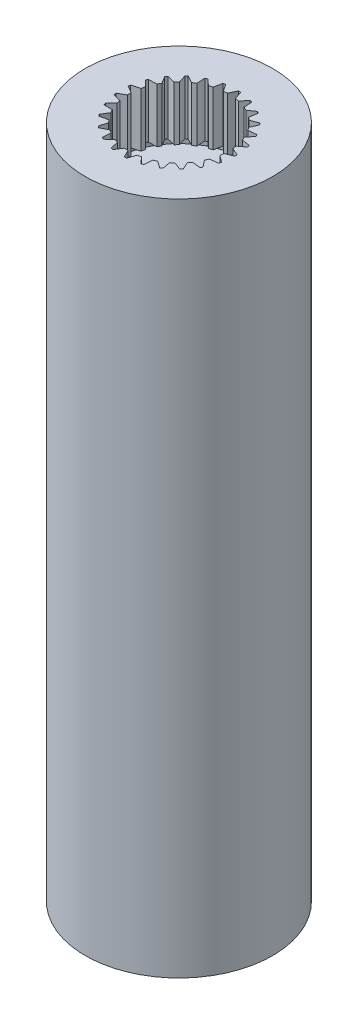
from build123d import *

# Parameters (mm, degrees)
SKETCH1_W          = 5
SKETCH1_H          = 36
SKETCH2_R          = 3.43154
CUT_EXTRUDE1_DEPTH = 0.5
SKETCH3_R          = 3.5
CUT_EXTRUDE2_DEPTH = 31.5
CUT_EXTRUDE3_REACH = 34.284
SKETCH4_R          = 1.5
CUT_EXTRUDE4_REACH = 38.688


with BuildPart() as part:
    # Sketch1 → Revolve1 (revolve)
    with BuildSketch(Plane.XY, mode=Mode.PRIVATE) as revolve1_sk:
        with Locations((2.5, 16.5)):
            Rectangle(SKETCH1_W, SKETCH1_H)
    revolve(revolve1_sk.sketch.rotate(Axis((0, 34.5, 0), (0, -1, 0)), 270), axis=Axis((0, 34.5, 0), (0, -1, 0)))

    # Sketch2 → Cut-Extrude1 (cut)
    with BuildSketch(Plane(origin=(0, 31.6, 0), x_dir=(1, 0, 0), z_dir=(0, 1, 0))):
        with Locations(Location((0, 0, 0), (0, 0, 90))):
            Circle(SKETCH2_R)
    extrude(amount=-CUT_EXTRUDE1_DEPTH, mode=Mode.SUBTRACT)

    # Sketch3 → Cut-Extrude2 (cut)
    with BuildSketch(Plane.XZ.offset(1.5)):
        with Locations(Location((0, 0, 0), (0, 0, 90))):
            Circle(SKETCH3_R)
    extrude(amount=-CUT_EXTRUDE2_DEPTH, mode=Mode.SUBTRACT)

    # Sketch4 → Cut-Extrude3 (cut, up to next)
    with BuildSketch(Plane.XZ.offset(-30), mode=Mode.PRIVATE) as cut_extrude3_sk1:
        with Locations(Location((0, 0, 0), (0, 0, 270))):
            Circle(SKETCH4_R)
    cut_extrude3_tool1 = extrude(cut_extrude3_sk1.sketch, amount=-CUT_EXTRUDE3_REACH, mode=Mode.PRIVATE) & part.part
    add(cut_extrude3_tool1.solids().sort_by_distance((0, 30, 0))[0], mode=Mode.SUBTRACT)

    # Sketch5 → Cut-Extrude4 (cut, up to next)
    with BuildSketch(Plane(origin=(0, 34.5, 0), x_dir=(-1, 0, 0), z_dir=(0, 1, 0)), mode=Mode.PRIVATE) as cut_extrude4_sk1:
        with BuildLine():
            Line((2.430309722, 1.842849602), (1.999275165, 1.739367361))
            ThreePointArc((1.999275165, 1.739367361), (1.931766863, 1.814049831), (1.861470643, 1.886114272))
            Line((1.861470643, 1.886114272), (1.991813569, 2.309800577))
            ThreePointArc((1.991813569, 2.309800577), (1.944143169, 2.35006539), (1.895659013, 2.389346544))
            Line((1.895659013, 2.389346544), (1.503901187, 2.181921452))
            ThreePointArc((1.503901187, 2.181921452), (1.419941007, 2.237469003), (1.333931574, 2.289787448))
            Line((1.333931574, 2.289787448), (1.354813039, 2.732577836))
            ThreePointArc((1.354813039, 2.732577836), (1.298626839, 2.75972251), (1.241897077, 2.785712054))
            Line((1.241897077, 2.785712054), (0.914031566, 2.487377393))
            ThreePointArc((0.914031566, 2.487377393), (0.818895035, 2.520299768), (0.722576679, 2.549584857))
            Line((0.722576679, 2.549584857), (0.632684622, 2.98365718))
            ThreePointArc((0.632684622, 2.98365718), (0.571513009, 2.995976115), (0.51010218, 3.007041032))
            Line((0.51010218, 3.007041032), (0.26672998, 2.636542265))
            ThreePointArc((0.26672998, 2.636542265), (0.166394877, 2.64477083), (0.065819633, 2.649182473))
            Line((0.065819633, 2.649182473), (-0.129197696, 3.047262371))
            ThreePointArc((-0.129197696, 3.047262371), (-0.191511085, 3.043981522), (-0.253744312, 3.039426562))
            Line((-0.253744312, 3.039426562), (-0.397331231, 2.620043491))
            ThreePointArc((-0.397331231, 2.620043491), (-0.496560484, 2.603061214), (-0.595073102, 2.582322211))
            Line((-0.595073102, 2.582322211), (-0.882962048, 2.919396859))
            ThreePointArc((-0.882962048, 2.919396859), (-0.942501833, 2.900722375), (-1.001647117, 2.880833743))
            Line((-1.001647117, 2.880833743), (-1.03642666, 2.438917747))
            ThreePointArc((-1.03642666, 2.438917747), (-1.128315123, 2.397791689), (-1.218575206, 2.353205148))
            Line((-1.218575206, 2.353205148), (-1.581246647, 2.608094906))
            ThreePointArc((-1.581246647, 2.608094906), (-1.634271725, 2.575200173), (-1.686612749, 2.541227545))
            Line((-1.686612749, 2.541227545), (-1.61039959, 2.104545832))
            ThreePointArc((-1.61039959, 2.104545832), (-1.689173573, 2.041860093), (-1.765509747, 1.976227551))
            Line((-1.765509747, 1.976227551), (-2.180175704, 2.132916759))
            ThreePointArc((-2.180175704, 2.132916759), (-2.223354314, 2.087868673), (-2.2656023, 2.041946674))
            Line((-2.2656023, 2.041946674), (-2.083185191, 1.637937563))
            ThreePointArc((-2.083185191, 1.637937563), (-2.143895035, 1.557630919), (-2.201510819, 1.475076308))
            Line((-2.201510819, 1.475076308), (-2.642116303, 1.523719607))
            ThreePointArc((-2.642116303, 1.523719607), (-2.672735374, 1.469348706), (-2.702235725, 1.414362784))
            Line((-2.702235725, 1.414362784), (-2.425076605, 1.068411652))
            ThreePointArc((-2.425076605, 1.068411652), (-2.463907688, 0.975530065), (-2.499182869, 0.881240596))
            Line((-2.499182869, 0.881240596), (-2.938043018, 0.818781548))
            ThreePointArc((-2.938043018, 0.818781548), (-2.954178641, 0.758504156), (-2.969077742, 0.697909279))
            Line((-2.969077742, 0.697909279), (-2.614591538, 0.431753508))
            ThreePointArc((-2.614591538, 0.431753508), (-2.629103958, 0.332133069), (-2.639822068, 0.232033297))
            Line((-2.639822068, 0.232033297), (-3.049361685, 0.062396433))
            ThreePointArc((-3.049361685, 0.062396433), (-3.05, 0), (-3.049361685, -0.062396433))
            Line((-3.049361685, -0.062396433), (-2.639822068, -0.232033297))
            ThreePointArc((-2.639822068, -0.232033297), (-2.629103958, -0.332133069), (-2.614591538, -0.431753508))
            Line((-2.614591538, -0.431753508), (-2.969077742, -0.697909279))
            ThreePointArc((-2.969077742, -0.697909279), (-2.954178641, -0.758504156), (-2.938043018, -0.818781548))
            Line((-2.938043018, -0.818781548), (-2.499182869, -0.881240596))
            ThreePointArc((-2.499182869, -0.881240596), (-2.463907688, -0.975530065), (-2.425076605, -1.068411652))
            Line((-2.425076605, -1.068411652), (-2.702235725, -1.414362784))
            ThreePointArc((-2.702235725, -1.414362784), (-2.672735374, -1.469348706), (-2.642116303, -1.523719607))
            Line((-2.642116303, -1.523719607), (-2.201510819, -1.475076308))
            ThreePointArc((-2.201510819, -1.475076308), (-2.143895035, -1.557630919), (-2.083185191, -1.637937563))
            Line((-2.083185191, -1.637937563), (-2.2656023, -2.041946674))
            ThreePointArc((-2.2656023, -2.041946674), (-2.223354314, -2.087868673), (-2.180175704, -2.132916759))
            Line((-2.180175704, -2.132916759), (-1.765509747, -1.976227551))
            ThreePointArc((-1.765509747, -1.976227551), (-1.689173573, -2.041860093), (-1.61039959, -2.104545832))
            Line((-1.61039959, -2.104545832), (-1.686612749, -2.541227545))
            ThreePointArc((-1.686612749, -2.541227545), (-1.634271725, -2.575200173), (-1.581246647, -2.608094906))
            Line((-1.581246647, -2.608094906), (-1.218575206, -2.353205148))
            ThreePointArc((-1.218575206, -2.353205148), (-1.128315123, -2.397791689), (-1.03642666, -2.438917747))
            Line((-1.03642666, -2.438917747), (-1.001647117, -2.880833743))
            ThreePointArc((-1.001647117, -2.880833743), (-0.942501833, -2.900722375), (-0.882962048, -2.919396859))
            Line((-0.882962048, -2.919396859), (-0.595073102, -2.582322211))
            ThreePointArc((-0.595073102, -2.582322211), (-0.496560484, -2.603061214), (-0.397331231, -2.620043491))
            Line((-0.397331231, -2.620043491), (-0.253744312, -3.039426562))
            ThreePointArc((-0.253744312, -3.039426562), (-0.191511085, -3.043981522), (-0.129197696, -3.047262371))
            Line((-0.129197696, -3.047262371), (0.065819633, -2.649182473))
            ThreePointArc((0.065819633, -2.649182473), (0.166394877, -2.64477083), (0.26672998, -2.636542265))
            Line((0.26672998, -2.636542265), (0.51010218, -3.007041032))
            ThreePointArc((0.51010218, -3.007041032), (0.571513009, -2.995976115), (0.632684622, -2.98365718))
            Line((0.632684622, -2.98365718), (0.722576679, -2.549584857))
            ThreePointArc((0.722576679, -2.549584857), (0.818895035, -2.520299768), (0.914031566, -2.487377393))
            Line((0.914031566, -2.487377393), (1.241897077, -2.785712054))
            ThreePointArc((1.241897077, -2.785712054), (1.298626839, -2.75972251), (1.354813039, -2.732577836))
            Line((1.354813039, -2.732577836), (1.333931574, -2.289787448))
            ThreePointArc((1.333931574, -2.289787448), (1.419941007, -2.237469003), (1.503901187, -2.181921452))
            Line((1.503901187, -2.181921452), (1.895659013, -2.389346544))
            ThreePointArc((1.895659013, -2.389346544), (1.944143169, -2.35006539), (1.991813569, -2.309800577))
            Line((1.991813569, -2.309800577), (1.861470643, -1.886114272))
            ThreePointArc((1.861470643, -1.886114272), (1.931766863, -1.814049831), (1.999275165, -1.739367361))
            Line((1.999275165, -1.739367361), (2.430309722, -1.842849602))
            ThreePointArc((2.430309722, -1.842849602), (2.467501833, -1.792745019), (2.503661128, -1.741890052))
            Line((2.503661128, -1.741890052), (2.272046665, -1.3639296))
            ThreePointArc((2.272046665, -1.3639296), (2.322212702, -1.276647236), (2.369027332, -1.187522421))
            Line((2.369027332, -1.187522421), (2.812255133, -1.180559643))
            ThreePointArc((2.812255133, -1.180559643), (2.835818282, -1.122779886), (2.858194451, -1.06453017))
            Line((2.858194451, -1.06453017), (2.539861639, -0.756044214))
            ThreePointArc((2.539861639, -0.756044214), (2.566745377, -0.659028201), (2.589924799, -0.561061081))
            Line((2.589924799, -0.561061081), (3.01749621, -0.444090779))
            ThreePointArc((3.01749621, -0.444090779), (3.025949839, -0.382266362), (3.033136904, -0.320281942))
            Line((3.033136904, -0.320281942), (2.648087766, -0.100653791))
            ThreePointArc((2.648087766, -0.100653791), (2.65, 0), (2.648087766, 0.100653791))
            Line((2.648087766, 0.100653791), (3.033136904, 0.320281942))
            ThreePointArc((3.033136904, 0.320281942), (3.025949839, 0.382266362), (3.01749621, 0.444090779))
            Line((3.01749621, 0.444090779), (2.589924799, 0.561061081))
            ThreePointArc((2.589924799, 0.561061081), (2.566745377, 0.659028201), (2.539861639, 0.756044214))
            Line((2.539861639, 0.756044214), (2.858194451, 1.06453017))
            ThreePointArc((2.858194451, 1.06453017), (2.835818282, 1.122779886), (2.812255133, 1.180559643))
            Line((2.812255133, 1.180559643), (2.369027332, 1.187522421))
            ThreePointArc((2.369027332, 1.187522421), (2.322212702, 1.276647236), (2.272046665, 1.3639296))
            Line((2.272046665, 1.3639296), (2.503661128, 1.741890052))
            ThreePointArc((2.503661128, 1.741890052), (2.467501833, 1.792745019), (2.430309722, 1.842849602))
        make_face()
    cut_extrude4_tool1 = extrude(cut_extrude4_sk1.sketch, amount=-CUT_EXTRUDE4_REACH, mode=Mode.PRIVATE) & part.part
    add(cut_extrude4_tool1.solids().sort_by_distance((0, 34.5, 0))[0], mode=Mode.SUBTRACT)


solid = part.part
